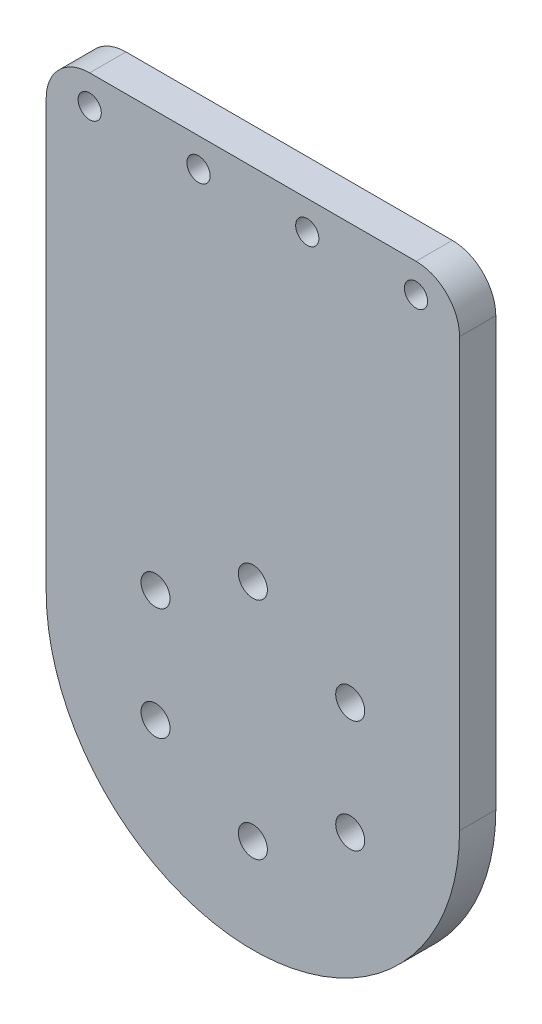
from build123d import *

# Parameters (mm, degrees)
EXTRUDE_1_DEPTH          = 5
CUT_EXTRUDE_2_REACH      = 73.149
SKETCH_4_R               = 2
SKETCH_5_OUTSIDE_W       = 80.924
SKETCH_5_OUTSIDE_H       = 117.424
SKETCH_5_OUTSIDE_R       = 1.6
CUT_EXTRUDE_3_DEPTH      = 72.149490511
FILLET_1_R               = 6
FILLET_2_R               = 6
PATTERN_CIRCULAR_1_COUNT = 6


with BuildPart() as part:
    # 草圖1 → 填料-伸長1 (new body)
    with BuildSketch(Plane.XY):
        with BuildLine():
            Line((28.5, 65), (-28.5, 65))
            Line((-28.5, 65), (-28.5, 55))
            Line((-28.5, 55), (-28.5, 0))
            ThreePointArc((-28.5, 0), (-26.682182849, -10.015543839), (-21.46062327, -18.753443653))
            ThreePointArc((-21.46062327, -18.753443653), (0, -28.5), (21.46062327, -18.753443653))
            ThreePointArc((21.46062327, -18.753443653), (26.682182849, -10.015543839), (28.5, 0))
            Line((28.5, 0), (28.5, 55.020450743))
            Line((28.5, 55.020450743), (28.5, 65))
        make_face()
    extrude(amount=EXTRUDE_1_DEPTH)

    # 草圖4 → 除料-伸長2 (cut, up to next)
    with BuildSketch(Plane.XY.offset(5), mode=Mode.PRIVATE) as cut_extrude_2_sk1:
        with Locations((0, -15.5)):
            Circle(SKETCH_4_R)
    cut_extrude_2_tool1 = extrude(cut_extrude_2_sk1.sketch, amount=-CUT_EXTRUDE_2_REACH, mode=Mode.PRIVATE) & part.part
    cut_extrude_2 = cut_extrude_2_tool1.solids().sort_by_distance((0, -15.5, 5))[0]
    add(cut_extrude_2, mode=Mode.SUBTRACT)

    # 草圖5 outside → 除料-伸長3 (cut, through all)
    # profile 1 of 5: a face of its own
    with BuildSketch(Plane.XY.offset(5)):
        with Locations((0, 18.25)):
            Rectangle(SKETCH_5_OUTSIDE_W, SKETCH_5_OUTSIDE_H)
        with BuildLine():
            Line((28.5, 65), (-28.5, 65))
            Line((-28.5, 65), (-28.5, 0))
            ThreePointArc((-28.5, 0), (0, -28.5), (28.5, 0))
            Line((28.5, 0), (28.5, 65))
        make_face(mode=Mode.SUBTRACT)
    # profile 2 of 5: a face of its own
    with BuildSketch(Plane.XY.offset(5)):
        with Locations((22.5, 61)):
            Circle(SKETCH_5_OUTSIDE_R)
    # profile 3 of 5: a face of its own
    with BuildSketch(Plane.XY.offset(5)):
        with Locations((7.5, 61)):
            Circle(SKETCH_5_OUTSIDE_R)
    # profile 4 of 5: a face of its own
    with BuildSketch(Plane.XY.offset(5)):
        with Locations((-7.5, 61)):
            Circle(SKETCH_5_OUTSIDE_R)
    # profile 5 of 5: a face of its own
    with BuildSketch(Plane.XY.offset(5)):
        with Locations((-22.5, 61)):
            Circle(SKETCH_5_OUTSIDE_R)
    extrude(amount=-CUT_EXTRUDE_3_DEPTH, mode=Mode.SUBTRACT)

    # 圓角1
    fillet_1_edges = [part.edges().sort_by_distance(p)[0] for p in [
        (-28.5, 65, 2.5),
    ]]
    fillet(fillet_1_edges, radius=FILLET_1_R)

    # 圓角2
    fillet_2_edges = [part.edges().sort_by_distance(p)[0] for p in [
        (28.5, 65, 2.5),
    ]]
    fillet(fillet_2_edges, radius=FILLET_2_R)

    # 環狀複製排列1: 除料-伸長2 ×6 about axis
    pattern_circular_1_axis = Axis((0, 0, 0), (0, 0, 1))
    for i in range(1, PATTERN_CIRCULAR_1_COUNT):
        add(cut_extrude_2.rotate(pattern_circular_1_axis, i * 360 / PATTERN_CIRCULAR_1_COUNT), mode=Mode.SUBTRACT)


solid = part.part
